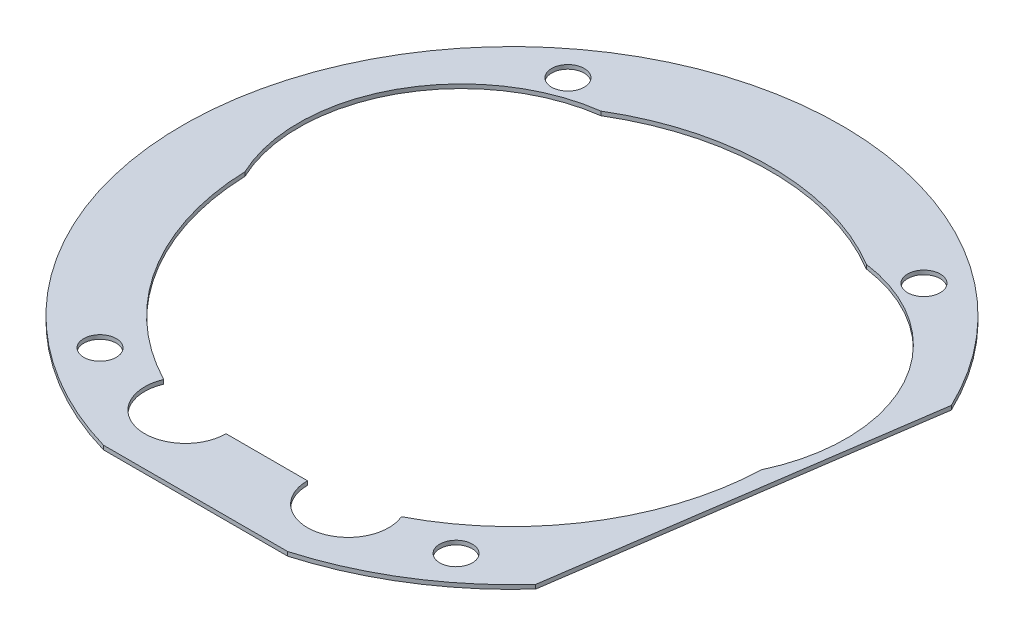
from build123d import *

# Parameters (mm, degrees)
SKETCH1_R           = 1.6
BOSS_EXTRUDE1_DEPTH = 0.4


with BuildPart() as part:
    # Sketch1 → Boss-Extrude1 (new body)
    with BuildSketch(Plane(origin=(0, 0, 0), x_dir=(1, 0, 0), z_dir=(0, 1, 0))):
        with BuildLine():
            Line((29.237843605, 13.960963482), (24.049079653, -21.711788683))
            ThreePointArc((24.049079653, -21.711788683), (17.208573183, -27.452231403), (9.060814288, -31.107260317))
            Line((9.060814288, -31.107260317), (-9.060814288, -31.107260317))
            ThreePointArc((-9.060814288, -31.107260317), (-24.689356555, 20.980840614), (29.237843605, 13.960963482))
        make_face()
        with Locations(Location((-17.5, 23, 0), (0, 0, 270))):
            Circle(SKETCH1_R, mode=Mode.SUBTRACT)
        with Locations(Location((-17.5, -23, 0), (0, 0, 270))):
            Circle(SKETCH1_R, mode=Mode.SUBTRACT)
        with Locations(Location((17.5, -23, 0), (0, 0, 270))):
            Circle(SKETCH1_R, mode=Mode.SUBTRACT)
        with Locations(Location((17.5, 23, 0), (0, 0, 270))):
            Circle(SKETCH1_R, mode=Mode.SUBTRACT)
        with BuildLine():
            Line((-4, -24.107260317), (4, -24.107260317))
            ThreePointArc((4, -24.107260317), (8.793181532, -28.027829543), (11.685431528, -22.552398764))
            ThreePointArc((11.685431528, -22.552398764), (21.475216761, -13.563740822), (25.385385277, -0.861518628))
            ThreePointArc((25.385385277, -0.861518628), (24.952949632, 13.588699396), (13.048984262, 21.791833556))
            ThreePointArc((13.048984262, 21.791833556), (0, 25.4), (-13.048984262, 21.791833556))
            ThreePointArc((-13.048984262, 21.791833556), (-24.952949632, 13.588699396), (-25.385385277, -0.861518628))
            ThreePointArc((-25.385385277, -0.861518628), (-21.475216761, -13.563740822), (-11.685431528, -22.552398764))
            ThreePointArc((-11.685431528, -22.552398764), (-8.793181532, -28.027829543), (-4, -24.107260317))
        make_face(mode=Mode.SUBTRACT)
    extrude(amount=BOSS_EXTRUDE1_DEPTH)


solid = part.part
